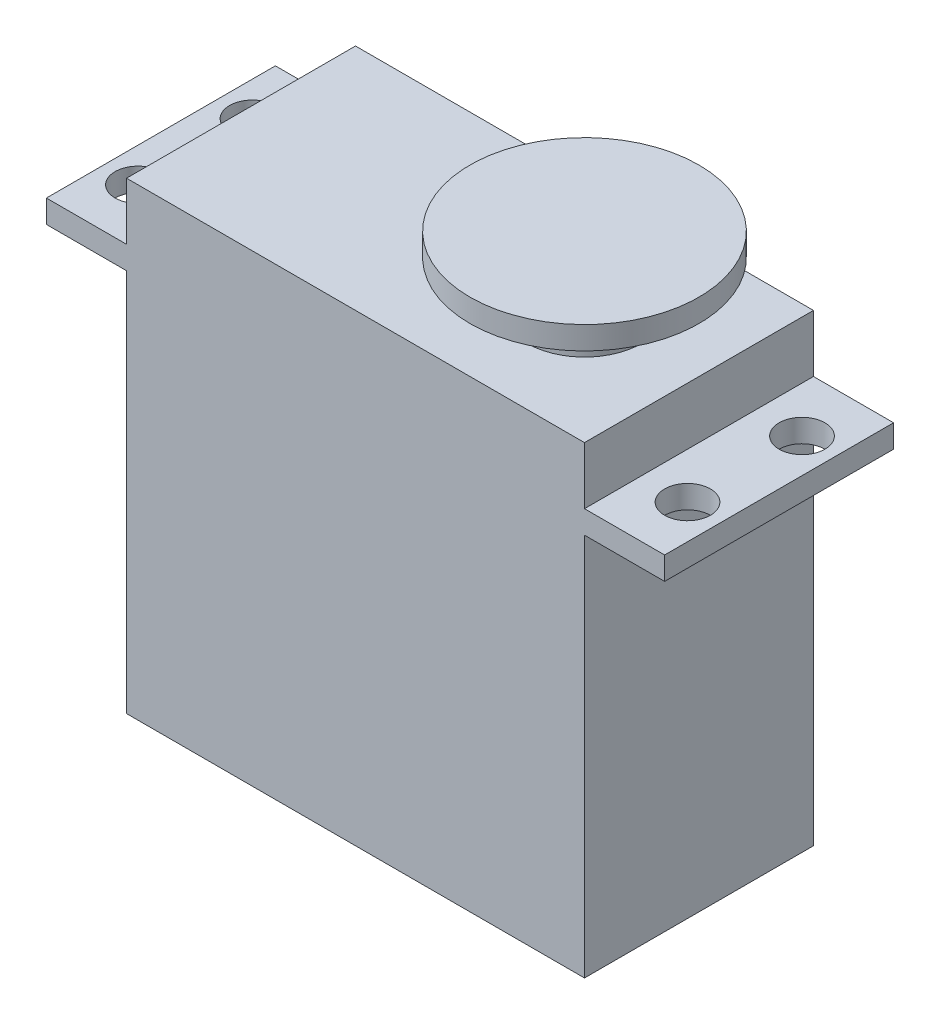
from build123d import *

# Parameters (mm, degrees)
SKETCH1_W           = 40
SKETCH1_H           = 40.5
BOSS_EXTRUDE1_DEPTH = 20
SKETCH2_R           = 10
BOSS_EXTRUDE2_DEPTH = 6
SKETCH5_R           = 10
SKETCH5_R_2         = 5
CUT_EXTRUDE3_DEPTH  = 4
SKETCH6_W           = 20
SKETCH6_H           = 2
BOSS_EXTRUDE3_DEPTH = 7
SKETCH7_R           = 2
CUT_EXTRUDE5_DEPTH  = 2


with BuildPart() as part:
    # Sketch1 → Boss-Extrude1 (new body)
    with BuildSketch(Plane.XY):
        with Locations((20, 20.25)):
            Rectangle(SKETCH1_W, SKETCH1_H)
    extrude(amount=BOSS_EXTRUDE1_DEPTH)

    # Sketch2 → Boss-Extrude2 (add)
    with BuildSketch(Plane(origin=(0, 40.5, 0), x_dir=(1, 0, 0), z_dir=(0, 1, 0))):
        with Locations(Location((30, -10, 0), (0, 0, 270))):
            Circle(SKETCH2_R)
    extrude(amount=BOSS_EXTRUDE2_DEPTH)

    # Sketch5 → Cut-Extrude3 (cut)
    with BuildSketch(Plane(origin=(0, 40.5, 0), x_dir=(1, 0, 0), z_dir=(0, 1, 0))):
        with Locations(Location((30, -10, 0), (0, 0, 270))):
            Circle(SKETCH5_R)
        with Locations(Location((30, -10, 0), (0, 0, 270))):
            Circle(SKETCH5_R_2, mode=Mode.SUBTRACT)
    extrude(amount=CUT_EXTRUDE3_DEPTH, mode=Mode.SUBTRACT)

    # Sketch6 → Boss-Extrude3 (add)
    with BuildSketch(Plane.ZY):
        with Locations((10, 34.5)):
            Rectangle(SKETCH6_W, SKETCH6_H)
    boss_extrude3 = extrude(amount=BOSS_EXTRUDE3_DEPTH)

    # Sketch7 → Cut-Extrude5 (cut)
    with BuildSketch(Plane(origin=(0, 35.5, 0), x_dir=(1, 0, 0), z_dir=(0, 1, 0))):
        with Locations(Location((-4, -15, 0), (0, 0, 270))):
            Circle(SKETCH7_R)
        with Locations(Location((-4, -5, 0), (0, 0, 270))):
            Circle(SKETCH7_R)
    cut_extrude5 = extrude(amount=-CUT_EXTRUDE5_DEPTH, mode=Mode.SUBTRACT)

    # Mirror1: Boss-Extrude3, Cut-Extrude5 across plane
    add(boss_extrude3.mirror(Plane.ZY.offset(-20)))
    add(cut_extrude5.mirror(Plane.ZY.offset(-20)), mode=Mode.SUBTRACT)


solid = part.part
